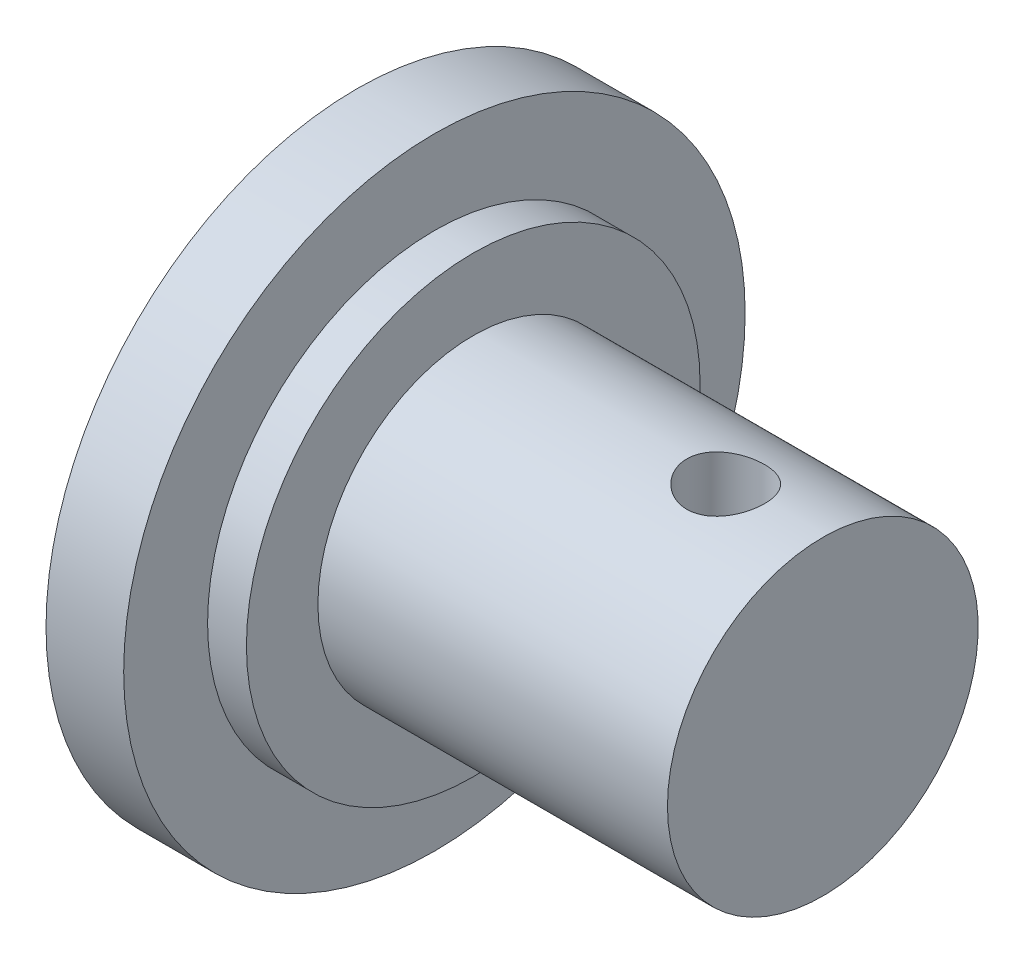
from build123d import *

# Parameters (mm, degrees)
F_10_32_TAPPED_HOLE2_D           = 4.0386
F_10_32_TAPPED_HOLE2_DEPTH       = 11.176
F_10_32_TAPPED_HOLE2_CBORE_D     = 4.826
F_10_32_TAPPED_HOLE2_CBORE_DEPTH = 9.652
F_10_32_TAPPED_HOLE2_TIP         = 1.213317848
CUT_EXTRUDE1_DEPTH               = 864.378412287
CUT_EXTRUDE1_DEPTH_BACK          = 864.378412287
SKETCH2_3_R                      = 1.5875


with BuildPart() as part:
    # Sketch2 → Revolve1 (revolve)
    with BuildSketch(Plane(origin=(0, 0, 0), x_dir=(1, 0, 0), z_dir=(0, 1, 0))):
        Polygon((135.001, 849.428797606), (135.001, 836.728797606), (154.051, 836.728797606), (154.051, 843.078797606), (139.7635, 843.078797606), (139.7635, 845.999797606), (138.176, 845.999797606), (138.176, 849.428797606), align=None)
    revolve(axis=Axis((135.001, 0, -836.728797606), (1, 0, 0)))

    # #10-32 Tapped Hole2
    with Locations(Plane.ZY.offset(-135.001)):
        with Locations((-836.728797606, 0)):
            CounterBoreHole(F_10_32_TAPPED_HOLE2_D / 2, F_10_32_TAPPED_HOLE2_CBORE_D / 2, F_10_32_TAPPED_HOLE2_CBORE_DEPTH, depth=F_10_32_TAPPED_HOLE2_DEPTH)
            with Locations((0, 0, -(F_10_32_TAPPED_HOLE2_DEPTH + F_10_32_TAPPED_HOLE2_TIP / 2))):  # 118° drill point
                Cone(0, F_10_32_TAPPED_HOLE2_D / 2, F_10_32_TAPPED_HOLE2_TIP, mode=Mode.SUBTRACT)

    # Sketch2<3> → Cut-Extrude1 (cut, two sides: drawn at the far end of the back side and taken through both)
    with BuildSketch(Plane(origin=(0, 0, 0), x_dir=(1, 0, 0), z_dir=(0, 1, 0)).offset(-CUT_EXTRUDE1_DEPTH_BACK)):
        with Locations((150.08225, 836.728797606)):
            Circle(SKETCH2_3_R)
    extrude(amount=CUT_EXTRUDE1_DEPTH + CUT_EXTRUDE1_DEPTH_BACK, mode=Mode.SUBTRACT)


solid = part.part
